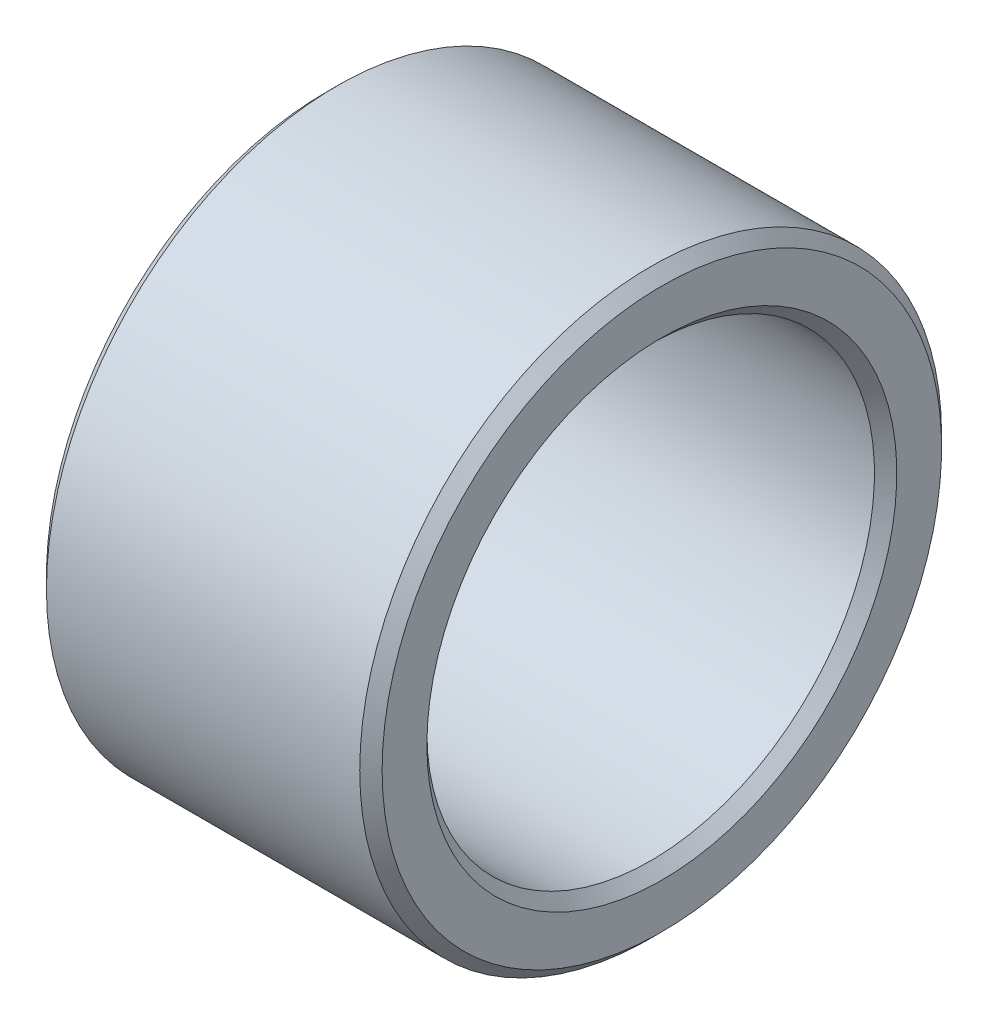
from build123d import *

# Parameters (mm, degrees)
SKICA1_W     = 15
SKICA1_H     = 3
ZKOSIT1_SIZE = 0.5


with BuildPart() as part:
    # Skica1 → Otočit kolem osy1 (revolve)
    with BuildSketch(Plane.XY, mode=Mode.PRIVATE) as oto_it_kolem_osy1_sk:
        with Locations((7.5, 11.5)):
            Rectangle(SKICA1_W, SKICA1_H)
    revolve(oto_it_kolem_osy1_sk.sketch.rotate(Axis((0, 0, 0), (1, 0, 0)), 90), axis=Axis((0, 0, 0), (1, 0, 0)))

    # Zkosit1
    zkosit1_edges = [part.edges().sort_by_distance(p)[0] for p in [
        (0, 0, -10),
        (15, 0, -10),
        (15, 0, -13),
        (0, 0, -13),
    ]]
    chamfer(zkosit1_edges, length=ZKOSIT1_SIZE)


solid = part.part
